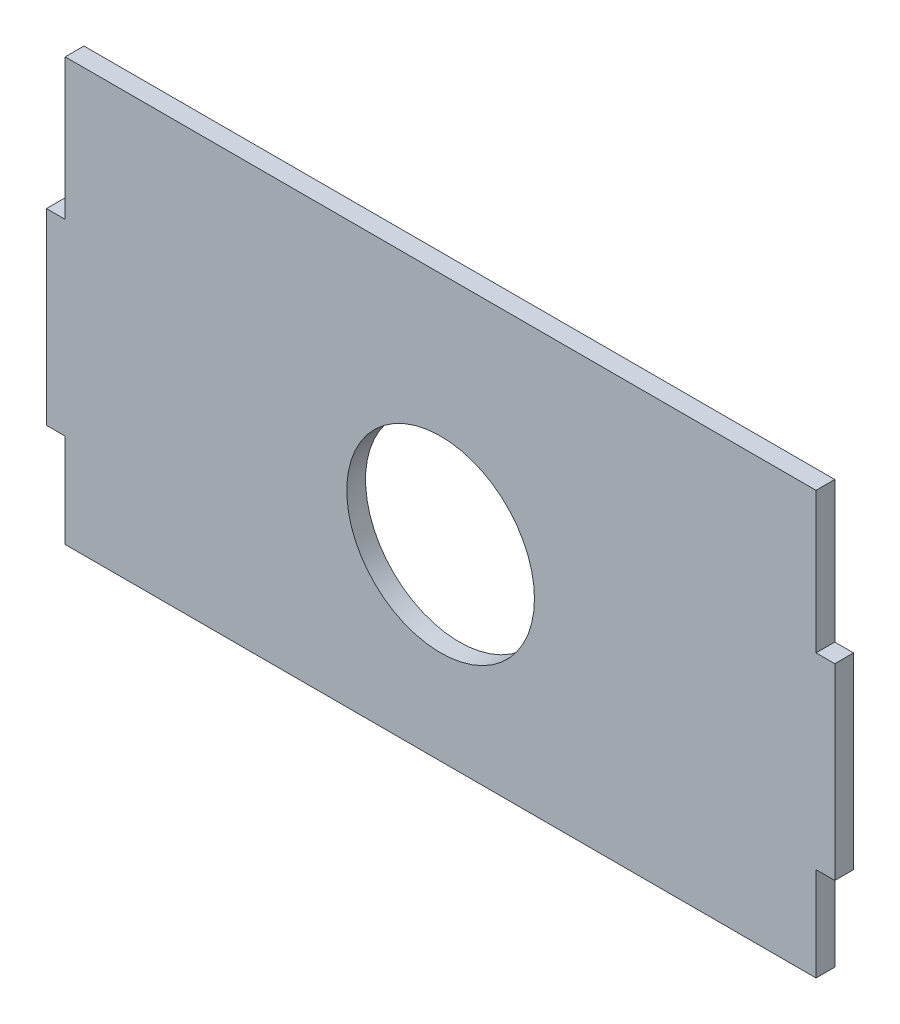
from build123d import *

# Parameters (mm, degrees)
SKETCH_1_W      = 80
SKETCH_1_H      = 45
SKETCH_1_R      = 10
SKETCH_1_W_2    = 2
SKETCH_1_H_2    = 20
EXTRUDE_1_DEPTH = 2


with BuildPart() as part:
    # Эскиз1 → Бобышка-Вытянуть1 (new body)
    # profile 1 of 3: a face of its own
    with BuildSketch(Plane.XY):
        with Locations((40, 22.5)):
            Rectangle(SKETCH_1_W, SKETCH_1_H)
        with Locations((40, 20)):
            Circle(SKETCH_1_R, mode=Mode.SUBTRACT)
    # profile 2 of 3: a face of its own
    with BuildSketch(Plane.XY):
        with Locations((81, 20)):
            Rectangle(SKETCH_1_W_2, SKETCH_1_H_2)
    # profile 3 of 3: a face of its own
    with BuildSketch(Plane.XY):
        with Locations((-1, 20)):
            Rectangle(SKETCH_1_W_2, SKETCH_1_H_2)
    extrude(amount=EXTRUDE_1_DEPTH)


solid = part.part
